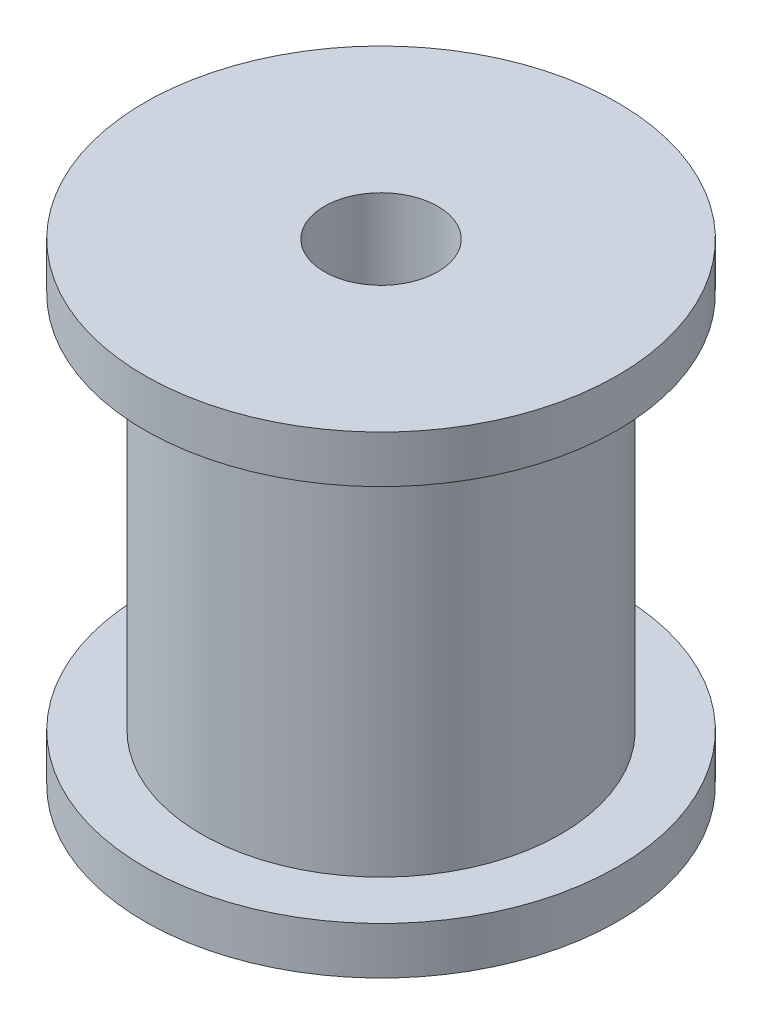
from build123d import *


with BuildPart() as part:
    # 草图1 → 旋转1 (revolve)
    with BuildSketch(Plane.XY):
        Polygon((3, -12.5), (3, 12.5), (12.5, 12.5), (12.5, 10), (9.5, 10), (9.5, -10), (12.5, -10), (12.5, -12.5), align=None)
    revolve(axis=Axis((0, -219.733791514, 0), (0, 1, 0)))


solid = part.part
